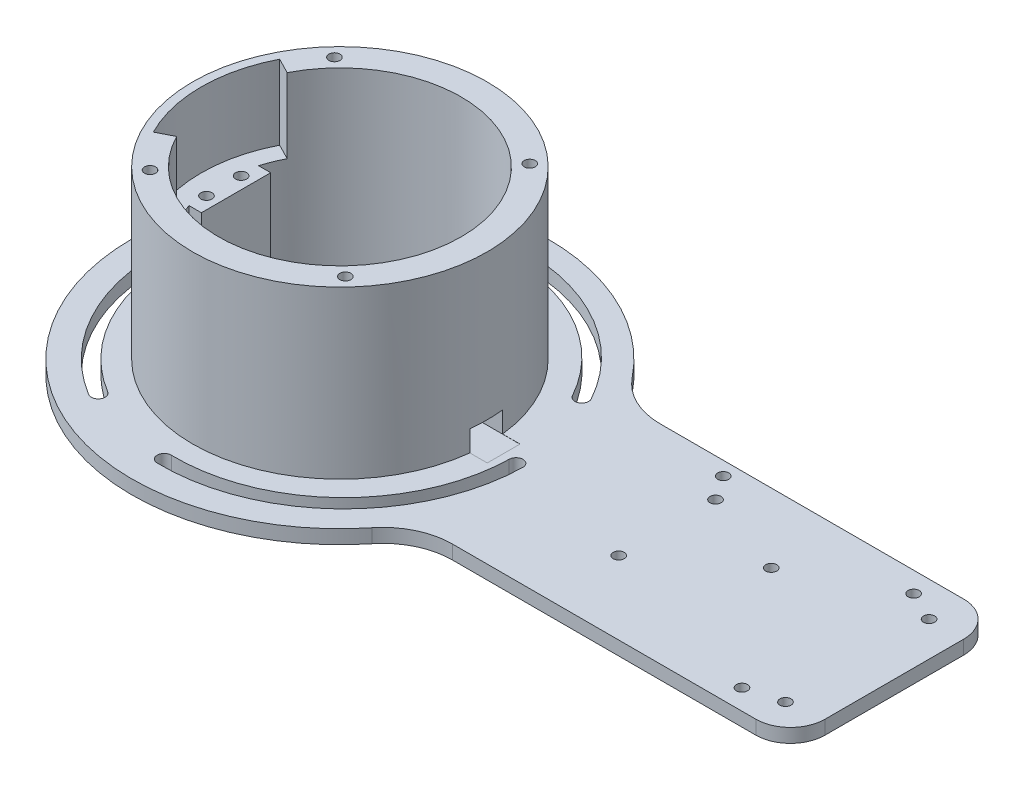
from build123d import *

# Parameters (mm, degrees)
SKETCH1_R           = 35
BOSS_EXTRUDE1_DEPTH = 4
SKETCH2_R           = 42.5
SKETCH2_R_2         = 35
BOSS_EXTRUDE2_DEPTH = 48
SKETCH3_R           = 1.6
CUT_EXTRUDE1_DEPTH  = 48
SKETCH4_R           = 1.6
CUT_EXTRUDE2_DEPTH  = 10
SKETCH8_R           = 1.6
CUT_EXTRUDE6_DEPTH  = 15
SKETCH10_R          = 1.6
CUT_EXTRUDE8_DEPTH  = 10
BOSS_EXTRUDE3_DEPTH = 30.5
CHAMFER1_SIZE       = 20
CUT_EXTRUDE11_DEPTH = 21.5
SKETCH15_R          = 1.6
CUT_EXTRUDE13_DEPTH = 46
SKETCH16_W          = 9.455259108
SKETCH16_H          = 6.083224026
CUT_EXTRUDE15_DEPTH = 35


with BuildPart() as part:
    # Sketch1 → Boss-Extrude1 (new body)
    with BuildSketch(Plane(origin=(0, 0, 0), x_dir=(1, 0, 0), z_dir=(0, 1, 0))):
        with BuildLine():
            Line((62.449979984, -30), (150, -30))
            ThreePointArc((150, -30), (157.071067812, -27.071067812), (160, -20))
            Line((160, -20), (160, 20))
            ThreePointArc((160, 20), (157.071067812, 27.071067812), (150, 30))
            Line((150, 30), (62.449979984, 30))
            ThreePointArc((62.449979984, 30), (53.789725946, 31.972243623), (46.837484988, 37.5))
            ThreePointArc((46.837484988, 37.5), (-60, 0), (46.837484988, -37.5))
            ThreePointArc((46.837484988, -37.5), (53.789725946, -31.972243623), (62.449979984, -30))
        make_face()
        with Locations(Location((0, 0, 0), (0, 0, 270))):
            Circle(SKETCH1_R, mode=Mode.SUBTRACT)
    extrude(amount=BOSS_EXTRUDE1_DEPTH)

    # Sketch2 → Boss-Extrude2 (add)
    with BuildSketch(Plane(origin=(0, 4, 0), x_dir=(1, 0, 0), z_dir=(0, 1, 0))):
        with Locations(Location((0, 0, 0), (0, 0, 270))):
            Circle(SKETCH2_R)
        with Locations(Location((0, 0, 0), (0, 0, 270))):
            Circle(SKETCH2_R_2, mode=Mode.SUBTRACT)
    extrude(amount=BOSS_EXTRUDE2_DEPTH)

    # Sketch3 → Cut-Extrude1 (cut)
    with BuildSketch(Plane(origin=(0, 4, 0), x_dir=(1, 0, 0), z_dir=(0, 1, 0))):
        with Locations(Location((150, 20, 0), (0, 0, 270))):
            Circle(SKETCH3_R)
        with Locations(Location((150, -21.433629542, 0), (0, 0, 270))):
            Circle(SKETCH3_R)
        with BuildLine():
            ThreePointArc((-45.13862288, 27.337180296), (-51.248131898, -12.587520766), (-27.337180296, -45.13862288))
            ThreePointArc((-27.337180296, -45.13862288), (-24.590394929, -44.463959891), (-25.265057918, -41.717174524))
            ThreePointArc((-25.265057918, -41.717174524), (-47.363590779, -11.633403217), (-41.717174524, 25.265057918))
            ThreePointArc((-41.717174524, 25.265057918), (-42.391837513, 28.011843285), (-45.13862288, 27.337180296))
        make_face()
        with BuildLine():
            ThreePointArc((46.261369296, 26.251446503), (14.740318447, 51.504787048), (-25.405238706, 47.072846589))
            ThreePointArc((-25.405238706, 47.072846589), (-26.194356102, 44.356729189), (-23.478238701, 43.567611793))
            ThreePointArc((-23.478238701, 43.567611793), (13.624337923, 47.663616983), (42.756134499, 24.324446498))
            ThreePointArc((42.756134499, 24.324446498), (45.4722519, 23.535329102), (46.261369296, 26.251446503))
        make_face()
        with BuildLine():
            ThreePointArc((-0.378899838, -52.36040173), (37.251660029, -37.689041213), (53.48626558, -0.705998641))
            ThreePointArc((53.48626558, -0.705998641), (51.528597609, 1.335455771), (49.487143197, -0.6222122))
            ThreePointArc((49.487143197, -0.6222122), (34.483099434, -34.801988697), (-0.295113397, -48.361279348))
            ThreePointArc((-0.295113397, -48.361279348), (-2.336567809, -50.318947318), (-0.378899838, -52.36040173))
        make_face()
    extrude(amount=-CUT_EXTRUDE1_DEPTH, mode=Mode.SUBTRACT)

    # Sketch4 → Cut-Extrude2 (cut)
    with BuildSketch(Plane(origin=(0, 4, 0), x_dir=(1, 0, 0), z_dir=(0, 1, 0))):
        with Locations(Location((89.34, -8.89, 0), (0, 0, 270))):
            Circle(SKETCH4_R)
        with Locations(Location((89.34, 19.05, 0), (0, 0, 270))):
            Circle(SKETCH4_R)
        with Locations(Location((140.14, -24.13, 0), (0, 0, 270))):
            Circle(SKETCH4_R)
        with Locations(Location((141.41, 24.13, 0), (0, 0, 270))):
            Circle(SKETCH4_R)
    extrude(amount=-CUT_EXTRUDE2_DEPTH, mode=Mode.SUBTRACT)

    # Sketch8 → Cut-Extrude6 (cut)
    with BuildSketch(Plane(origin=(0, 52, 0), x_dir=(1, 0, 0), z_dir=(0, 1, 0))):
        with Locations(Location((-26.597013041, -28.18086935, 0), (0, 0, 270))):
            Circle(SKETCH8_R)
        with Locations(Location((-28.18086935, 26.597013041, 0), (0, 0, 270))):
            Circle(SKETCH8_R)
        with Locations(Location((26.597013041, 28.18086935, 0), (0, 0, 270))):
            Circle(SKETCH8_R)
        with Locations(Location((28.18086935, -26.597013041, 0), (0, 0, 270))):
            Circle(SKETCH8_R)
    extrude(amount=-CUT_EXTRUDE6_DEPTH, mode=Mode.SUBTRACT)

    # Sketch10 → Cut-Extrude8 (cut)
    with BuildSketch(Plane(origin=(0, 4, 0), x_dir=(1, 0, 0), z_dir=(0, 1, 0))):
        with Locations(Location((84.581, 26.035, 0), (0, 0, 270))):
            Circle(SKETCH10_R)
        with Locations(Location((114.426, 10.033, 0), (0, 0, 270))):
            Circle(SKETCH10_R)
    extrude(amount=-CUT_EXTRUDE8_DEPTH, mode=Mode.SUBTRACT)

    # Sketch12 → Boss-Extrude3 (add)
    with BuildSketch(Plane.XZ):
        with BuildLine():
            Line((-30.025, -10.060927898), (-30.025, 9.939072102))
            Line((-30.025, 9.939072102), (-33.559124627, 9.939072102))
            ThreePointArc((-33.559124627, 9.939072102), (-34.999942254, -0.063578173), (-33.522794183, -10.060927898))
            Line((-33.522794183, -10.060927898), (-30.025, -10.060927898))
        make_face()
        with BuildLine():
            Line((12.25, -10), (12.25, 10))
            Line((12.25, 10), (33.541019662, 10))
            ThreePointArc((33.541019662, 10), (35, 0), (33.541019662, -10))
            Line((33.541019662, -10), (12.25, -10))
        make_face()
    extrude(amount=-BOSS_EXTRUDE3_DEPTH)

    # Chamfer1
    chamfer1_edges = [part.edges().sort_by_distance(p)[0] for p in [
        (12.25, 0, 0),
    ]]
    chamfer(chamfer1_edges, length=CHAMFER1_SIZE)

    # Sketch14 → Cut-Extrude11 (cut)
    with BuildSketch(Plane(origin=(0, 52, 0), x_dir=(1, 0, 0), z_dir=(0, 1, 0))):
        with BuildLine():
            Line((0, 0), (-35.606142497, -18.226426322))
            ThreePointArc((-35.606142497, -18.226426322), (-40, 0), (-35.606142497, 18.226426322))
            Line((-35.606142497, 18.226426322), (0, 0))
        make_face()
    extrude(amount=-CUT_EXTRUDE11_DEPTH, mode=Mode.SUBTRACT)

    # Sketch15 → Cut-Extrude13 (cut)
    with BuildSketch(Plane(origin=(0, 52, 0), x_dir=(1, 0, 0), z_dir=(0, 1, 0))):
        with Locations(Location((-33.5, -5, 0), (0, 0, 270))):
            Circle(SKETCH15_R)
        with Locations(Location((-33.5, 5, 0), (0, 0, 270))):
            Circle(SKETCH15_R)
        with Locations(Location((15.1, -5, 0), (0, 0, 180))):
            Circle(SKETCH15_R)
        with Locations(Location((15.1, 5, 0), (0, 0, 180))):
            Circle(SKETCH15_R)
    extrude(amount=-CUT_EXTRUDE13_DEPTH, mode=Mode.SUBTRACT)

    # Sketch16 → Cut-Extrude15 (cut)
    with BuildSketch(Plane.ZY.offset(-12.25)):
        with Locations((0, 7)):
            Rectangle(SKETCH16_W, SKETCH16_H)
    extrude(amount=-CUT_EXTRUDE15_DEPTH, mode=Mode.SUBTRACT)


solid = part.part
